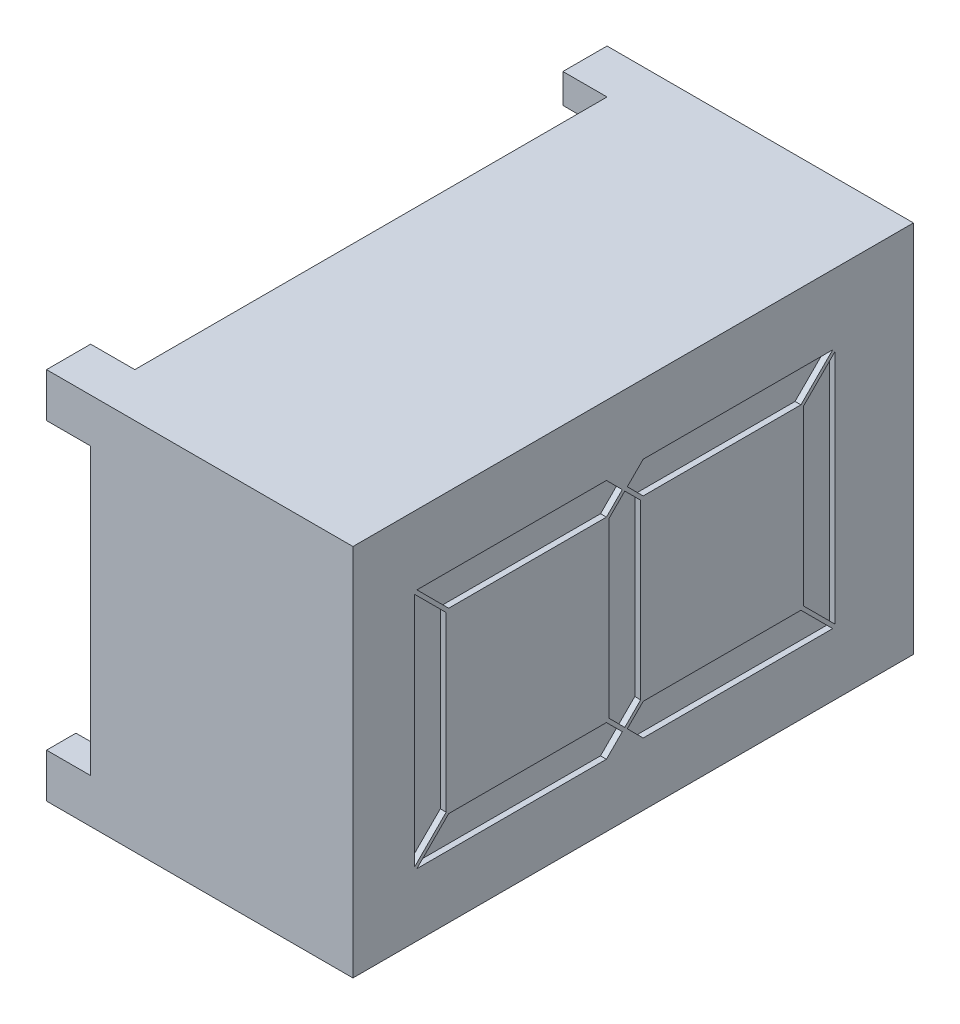
from build123d import *

# Parameters (mm, degrees)
SKETCH1_W           = 12.7
SKETCH1_H           = 19.05
BOSS_EXTRUDE1_DEPTH = 10.414
SKETCH2_W           = 10.7
SKETCH2_H           = 17.05
CUT_EXTRUDE1_DEPTH  = 2.414
SKETCH4_W           = 1.5
SKETCH4_H           = 16.05
CUT_EXTRUDE2_DEPTH  = 42.414
SKETCH5_W           = 1.5
SKETCH5_H           = 9.7
CUT_EXTRUDE3_DEPTH  = 42.414
CUT_EXTRUDE4_DEPTH  = 0.2


with BuildPart() as part:
    # Sketch1 → Boss-Extrude1 (new body)
    with BuildSketch(Plane.YZ):
        with Locations((10.524991597, -9.20910084)):
            Rectangle(SKETCH1_W, SKETCH1_H)
    extrude(amount=BOSS_EXTRUDE1_DEPTH)

    # Sketch2 → Cut-Extrude1 (cut)
    with BuildSketch(Plane(origin=(0, 0, 0), x_dir=(0, -1, 0), z_dir=(-1, 0, 0))):
        with Locations((-10.524991597, -9.20910084)):
            Rectangle(SKETCH2_W, SKETCH2_H)
    extrude(amount=-CUT_EXTRUDE1_DEPTH, mode=Mode.SUBTRACT)

    # Sketch4 → Cut-Extrude2 (cut)
    with BuildSketch(Plane(origin=(0, 16.874991597, 0), x_dir=(-1, 0, 0), z_dir=(0, 1, 0))):
        with Locations((-0.75, -9.20910084)):
            Rectangle(SKETCH4_W, SKETCH4_H)
    extrude(amount=-CUT_EXTRUDE2_DEPTH, mode=Mode.SUBTRACT)

    # Sketch5 → Cut-Extrude3 (cut)
    with BuildSketch(Plane(origin=(0, 0, -18.73410084), x_dir=(1, 0, 0), z_dir=(0, 0, -1))):
        with Locations((0.75, -10.524991597)):
            Rectangle(SKETCH5_W, SKETCH5_H)
    extrude(amount=-CUT_EXTRUDE3_DEPTH, mode=Mode.SUBTRACT)

    # Sketch6 → Cut-Extrude4 (cut)
    with BuildSketch(Plane.YZ.offset(10.414)):
        Polygon((7.471753677, -14.994134662), (13.347648049, -14.994134662), (14.427648049, -16.074134662), (6.391753677, -16.074134662), align=None)
        Polygon((14.427648049, -1.772534662), (6.391753677, -1.772534662), (7.471753677, -2.852534662), (13.347648049, -2.852534662), align=None)
        Polygon((13.432500863, -14.909281848), (13.432500863, -9.548187475), (13.972500863, -9.008187475), (14.512500863, -9.548187475), (14.512500863, -15.989281848), align=None)
        Polygon((7.386900863, -2.937387475), (6.306900863, -1.857387475), (6.306900863, -8.298481848), (6.846900863, -8.838481848), (7.386900863, -8.298481848), align=None)
        Polygon((13.432500863, -2.937387475), (14.512500863, -1.857387475), (14.512500863, -8.298481848), (13.972500863, -8.838481848), (13.432500863, -8.298481848), align=None)
        Polygon((7.471753677, -8.383334662), (13.347648049, -8.383334662), (13.887648049, -8.923334662), (13.347648049, -9.463334662), (7.471753677, -9.463334662), (6.931753677, -8.923334662), align=None)
        Polygon((6.846900863, -9.008187475), (6.306900863, -9.548187475), (6.306900863, -15.989281848), (7.386900863, -14.909281848), (7.386900863, -9.548187475), align=None)
    extrude(amount=-CUT_EXTRUDE4_DEPTH, mode=Mode.SUBTRACT)


solid = part.part
